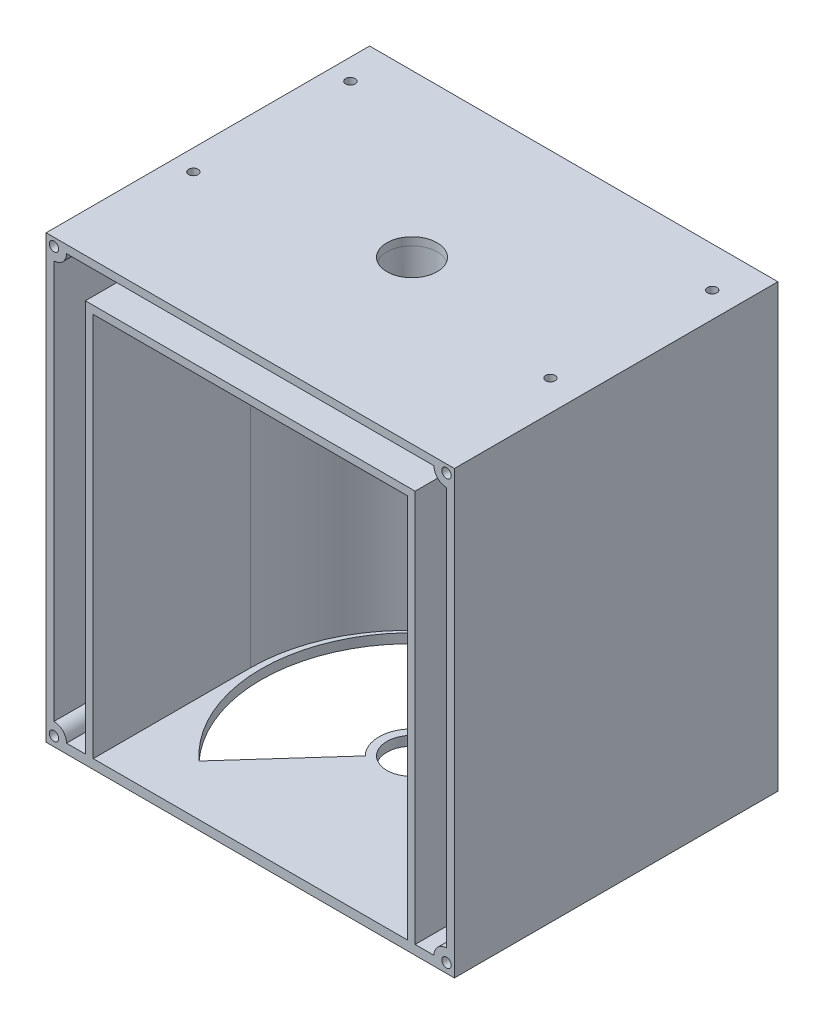
from build123d import *
from build123d.topology import SkipClean

# Parameters (mm, degrees)
BOSS_EXTRUDE2_DEPTH              = 2
BOSS_EXTRUDE2_DEPTH_BACK         = 3
SKETCH1_W                        = 105
SKETCH1_H                        = 155
SKETCH1_5_W                      = 105
SKETCH1_5_H                      = 155
SKETCH1_5_W_2                    = 100
SKETCH1_5_H_2                    = 150
BOSS_EXTRUDE3_DEPTH              = 100
BOSS_EXTRUDE5_DEPTH              = 153
CUT_EXTRUDE1_DEPTH               = 152.5
BOSS_EXTRUDE6_DEPTH              = 2.5
SKETCH5_R                        = 8
CUT_EXTRUDE2_DEPTH               = 162.5
BOSS_EXTRUDE12_DEPTH             = 3
BOSS_EXTRUDE13_DEPTH             = 103
BOSS_EXTRUDE14_DEPTH             = 3
CUT_EXTRUDE7_DEPTH               = 3
SKETCH15_W                       = 130
SKETCH15_H                       = 103
CUT_EXTRUDE8_DEPTH               = 30
SKETCH16_W                       = 130
SKETCH16_H                       = 103
BOSS_EXTRUDE15_DEPTH             = 3
SKETCH5_2_R                      = 8
CUT_EXTRUDE9_DEPTH               = 222
SKETCH18_R                       = 1.5
CUT_EXTRUDE11_DEPTH              = 5
BOSS_EXTRUDE17_REACH             = 203.791
SKETCH19_R                       = 10.02081528
SKETCH19_R_2                     = 8.1
BOSS_EXTRUDE17_DIRECTION_2_DEPTH = 7
SKETCH21_R                       = 1.5
CUT_EXTRUDE13_DEPTH              = 4
BOSS_EXTRUDE19_DEPTH             = 10
SKETCH22_3_R                     = 1.5
CUT_EXTRUDE14_DEPTH              = 10
CUT_EXTRUDE15_DEPTH              = 10


with BuildPart() as part:
    # Sketch1 → Boss-Extrude2 (new, two sides: drawn at the far end of the back side and taken through both)
    with BuildSketch(Plane.XY.offset(-BOSS_EXTRUDE2_DEPTH_BACK)):
        with Locations((-54.732014652, -17.403043174)):
            Rectangle(SKETCH1_W, SKETCH1_H)
    extrude(amount=BOSS_EXTRUDE2_DEPTH + BOSS_EXTRUDE2_DEPTH_BACK)

    # Sketch1<5> → Boss-Extrude3 (add)
    with BuildSketch(Plane.XY):
        with Locations((-54.732014652, -17.403043174)):
            Rectangle(SKETCH1_5_W, SKETCH1_5_H)
        with Locations((-54.732014652, -17.403043174)):
            Rectangle(SKETCH1_5_W_2, SKETCH1_5_H_2, mode=Mode.SUBTRACT)
    extrude(amount=BOSS_EXTRUDE3_DEPTH)

    # Sketch4 → Boss-Extrude5 (add)
    with BuildSketch(Plane.XZ.offset(94.903043174)):
        with BuildLine():
            ThreePointArc((-4.732014652, 50), (-14.732014652, 20), (-40.732014652, 2))
            Line((-40.732014652, 2), (-4.732014652, 2))
            Line((-4.732014652, 2), (-4.732014652, 50))
        make_face()
        with BuildLine():
            ThreePointArc((-68.732014652, 2), (-94.732014652, 20), (-104.732014652, 50))
            Line((-104.732014652, 50), (-104.732014652, 2))
            Line((-104.732014652, 2), (-68.732014652, 2))
        make_face()
    extrude(amount=-BOSS_EXTRUDE5_DEPTH)

    # Sketch4<3> → Cut-Extrude1 (cut)
    with SkipClean():  # the faces are left unmerged after this step: merging them gives an invalid solid
        with BuildSketch(Plane.XZ.offset(94.903043174)):
            with BuildLine():
                Line((-40.732014652, 2), (-68.732014652, 2))
                ThreePointArc((-68.732014652, 2), (-54.732014652, 0), (-40.732014652, 2))
            make_face()
        extrude(amount=-CUT_EXTRUDE1_DEPTH, mode=Mode.SUBTRACT)

    # Sketch4<4> → Boss-Extrude6 (add)
    with BuildSketch(Plane.XZ.offset(94.903043174)):
        with BuildLine():
            Line((-40.732014652, 2), (-68.732014652, 2))
            ThreePointArc((-68.732014652, 2), (-54.732014652, 0), (-40.732014652, 2))
        make_face()
    extrude(amount=-BOSS_EXTRUDE6_DEPTH)

    # Sketch5 → Cut-Extrude2 (cut)
    with BuildSketch(Plane.XZ.offset(94.903043174)):
        with Locations(Location((-54.732014652, 48.5, 0), (0, 0, 270))):
            Circle(SKETCH5_R)
    extrude(amount=-CUT_EXTRUDE2_DEPTH, mode=Mode.SUBTRACT)

    # Sketch13 → Boss-Extrude12 (add)
    with BuildSketch(Plane.XY.offset(100)):
        Polygon((-117.232014652, 70.096956826), (7.767985348, 70.096956826), (7.767985348, -92.403043174), (-2.232014652, -92.403043174), (-2.232014652, -94.903043174), (7.767985348, -94.903043174), (10.267985348, -94.903043174), (10.267985348, 72.596956826), (-119.732014652, 72.596956826), (-119.732014652, -94.903043174), (-117.232014652, -94.903043174), (-107.232014652, -94.903043174), (-107.232014652, -92.403043174), (-117.232014652, -92.403043174), align=None)
        Polygon((7.767985348, -92.403043174), (7.767985348, 70.096956826), (-117.232014652, 70.096956826), (-117.232014652, -92.403043174), (-107.232014652, -92.403043174), (-107.232014652, 60.096956826), (-2.232014652, 60.096956826), (-2.232014652, -92.403043174), align=None)
    extrude(amount=-BOSS_EXTRUDE12_DEPTH)

    # Sketch13<4> → Boss-Extrude13 (add)
    with BuildSketch(Plane.XY.offset(100)):
        Polygon((-117.232014652, 70.096956826), (7.767985348, 70.096956826), (7.767985348, -92.403043174), (-2.232014652, -92.403043174), (-2.232014652, -94.903043174), (7.767985348, -94.903043174), (10.267985348, -94.903043174), (10.267985348, 72.596956826), (-119.732014652, 72.596956826), (-119.732014652, -94.903043174), (-117.232014652, -94.903043174), (-107.232014652, -94.903043174), (-107.232014652, -92.403043174), (-117.232014652, -92.403043174), align=None)
    extrude(amount=-BOSS_EXTRUDE13_DEPTH)

    # Sketch14 → Boss-Extrude14 (add)
    with BuildSketch(Plane(origin=(0, 0, -3), x_dir=(-1, 0, 0), z_dir=(0, 0, -1))):
        Polygon((117.232014652, -92.403043174), (107.232014652, -92.403043174), (107.232014652, 60.096956826), (2.232014652, 60.096956826), (2.232014652, -92.403043174), (-7.767985348, -92.403043174), (-7.767985348, 70.096956826), (117.232014652, 70.096956826), align=None)
    extrude(amount=-BOSS_EXTRUDE14_DEPTH)

    # Sketch13<5> → Cut-Extrude7 (cut)
    with BuildSketch(Plane.XY.offset(100)):
        Polygon((7.767985348, -92.403043174), (7.767985348, 70.096956826), (-117.232014652, 70.096956826), (-117.232014652, -92.403043174), (-107.232014652, -92.403043174), (-107.232014652, 60.096956826), (-2.232014652, 60.096956826), (-2.232014652, -92.403043174), align=None)
    extrude(amount=-CUT_EXTRUDE7_DEPTH, mode=Mode.SUBTRACT)

    # Sketch15 → Cut-Extrude8 (cut)
    with BuildSketch(Plane.XZ.offset(94.903043174)):
        with Locations((-54.732014652, 48.5)):
            Rectangle(SKETCH15_W, SKETCH15_H)
    extrude(amount=-CUT_EXTRUDE8_DEPTH, mode=Mode.SUBTRACT)

    # Sketch16 → Boss-Extrude15 (add)
    with BuildSketch(Plane.XZ.offset(64.903043174)):
        with Locations((-54.732014652, 48.5)):
            Rectangle(SKETCH16_W, SKETCH16_H)
    extrude(amount=BOSS_EXTRUDE15_DEPTH)

    # Sketch5<2> → Cut-Extrude9 (cut)
    with BuildSketch(Plane.XZ.offset(94.903043174)):
        with Locations(Location((-54.732014652, 48.5, 0), (0, 0, 270))):
            Circle(SKETCH5_2_R)
    extrude(amount=-CUT_EXTRUDE9_DEPTH, mode=Mode.SUBTRACT)

    # Sketch18 → Cut-Extrude11 (cut)
    with BuildSketch(Plane.XZ.offset(67.903043174)):
        with Locations(Location((4.017985348, 80, 0), (0, 0, 270))):
            Circle(SKETCH18_R)
        with Locations(Location((4.017985348, 20, 0), (0, 0, 270))):
            Circle(SKETCH18_R)
        with Locations(Location((-113.482014652, 20, 0), (0, 0, 270))):
            Circle(SKETCH18_R)
        with Locations(Location((-113.482014652, 80, 0), (0, 0, 270))):
            Circle(SKETCH18_R)
    extrude(amount=-CUT_EXTRUDE11_DEPTH, mode=Mode.SUBTRACT)

    # Boss-Extrude17: up to this face of the body (flat: up to its plane)
    boss_extrude17_end = Plane(part.part.faces().sort_by_distance((-118.073430919, 72.596956826, 48.5))[0])
    # Sketch19 → Boss-Extrude17 (add, up to the picked face)
    with BuildSketch(Plane(origin=(0, 60.096956826, 0), x_dir=(1, 0, 0), z_dir=(0, 1, 0)), mode=Mode.PRIVATE) as boss_extrude17_sk1:
        with Locations(Location((-54.732014652, -48.5, 0), (0, 0, 270))):
            Circle(SKETCH19_R)
        with Locations(Location((-54.732014652, -48.5, 0), (0, 0, 270))):
            Circle(SKETCH19_R_2, mode=Mode.SUBTRACT)
    boss_extrude17_tool1 = split(extrude(boss_extrude17_sk1.sketch, amount=BOSS_EXTRUDE17_REACH, mode=Mode.PRIVATE), bisect_by=boss_extrude17_end, keep=Keep.BOTH, mode=Mode.PRIVATE)
    add(boss_extrude17_tool1.solids().sort_by(Axis((-54.732015, 60.096957, 38.762616), (0, 1, 0)))[0])

    # Sketch19 → Boss-Extrude17 direction 2 (add)
    with BuildSketch(Plane(origin=(0, 60.096956826, 0), x_dir=(1, 0, 0), z_dir=(0, 1, 0))):
        with Locations(Location((-54.732014652, -48.5, 0), (0, 0, 270))):
            Circle(SKETCH19_R)
        with Locations(Location((-54.732014652, -48.5, 0), (0, 0, 270))):
            Circle(SKETCH19_R_2, mode=Mode.SUBTRACT)
    extrude(amount=-BOSS_EXTRUDE17_DIRECTION_2_DEPTH)

    # Sketch21 → Cut-Extrude13 (cut)
    with BuildSketch(Plane(origin=(0, 72.596956826, 0), x_dir=(1, 0, 0), z_dir=(0, 1, 0))):
        with Locations(Location((0.634360514, -59.784654703, 0), (0, 0, 180))):
            Circle(SKETCH21_R)
        with Locations(Location((2.134360514, -9.784654703, 0), (0, 0, 180))):
            Circle(SKETCH21_R)
        with Locations(Location((-113.07774633, -9.784654703, 0), (0, 0, 180))):
            Circle(SKETCH21_R)
        with Locations(Location((-113.07774633, -59.784654703, 0), (0, 0, 180))):
            Circle(SKETCH21_R)
    extrude(amount=-CUT_EXTRUDE13_DEPTH, mode=Mode.SUBTRACT)

    # Sketch22 → Boss-Extrude19 (add)
    with BuildSketch(Plane.XY.offset(100)):
        with BuildLine():
            Line((-117.232014652, 68.596956826), (-117.232014652, 66.096956826))
            ThreePointArc((-117.232014652, 66.096956826), (-114.403587527, 67.268529702), (-113.232014652, 70.096956826))
            Line((-113.232014652, 70.096956826), (-115.732014652, 70.096956826))
            ThreePointArc((-115.732014652, 70.096956826), (-116.17135448, 69.036296655), (-117.232014652, 68.596956826))
        make_face()
        with BuildLine():
            Line((6.267985348, 70.096956826), (3.767985348, 70.096956826))
            ThreePointArc((3.767985348, 70.096956826), (4.939558223, 67.268529702), (7.767985348, 66.096956826))
            Line((7.767985348, 66.096956826), (7.767985348, 68.596956826))
            ThreePointArc((7.767985348, 68.596956826), (6.707325176, 69.036296655), (6.267985348, 70.096956826))
        make_face()
        with BuildLine():
            Line((7.767985348, -63.403043174), (7.767985348, -60.903043174))
            ThreePointArc((7.767985348, -60.903043174), (4.939558223, -62.074616049), (3.767985348, -64.903043174))
            Line((3.767985348, -64.903043174), (6.267985348, -64.903043174))
            ThreePointArc((6.267985348, -64.903043174), (6.707325176, -63.842383002), (7.767985348, -63.403043174))
        make_face()
        with BuildLine():
            ThreePointArc((-113.232014652, -64.903043174), (-114.403587527, -62.074616049), (-117.232014652, -60.903043174))
            Line((-117.232014652, -60.903043174), (-117.232014652, -63.403043174))
            ThreePointArc((-117.232014652, -63.403043174), (-116.17135448, -63.842383002), (-115.732014652, -64.903043174))
            Line((-115.732014652, -64.903043174), (-113.232014652, -64.903043174))
        make_face()
    extrude(amount=-BOSS_EXTRUDE19_DEPTH)

    # Sketch22<3> → Cut-Extrude14 (cut)
    with BuildSketch(Plane.XY.offset(100)):
        with Locations((7.767985348, 70.096956826)):
            Circle(SKETCH22_3_R)
        with Locations((7.767985348, -64.903043174)):
            Circle(SKETCH22_3_R)
        with Locations((-117.232014652, -64.903043174)):
            Circle(SKETCH22_3_R)
        with Locations((-117.232014652, 70.096956826)):
            Circle(SKETCH22_3_R)
    extrude(amount=-CUT_EXTRUDE14_DEPTH, mode=Mode.SUBTRACT)

    # Sketch23 → Cut-Extrude15 (cut)
    with BuildSketch(Plane.XZ.offset(67.903043174)):
        with BuildLine():
            Line((-54.054153523, 38.001044888), (-54.732014652, 0.5))
            ThreePointArc((-54.732014652, 0.5), (-99.452133799, 31.061222992), (-87.226355717, 83.828710686))
            Line((-87.226355717, 83.828710686), (-62.17135448, 55.939339828))
            ThreePointArc((-62.17135448, 55.939339828), (-64.317159664, 44.162656427), (-54.054153523, 38.001044888))
        make_face()
    extrude(amount=-CUT_EXTRUDE15_DEPTH, mode=Mode.SUBTRACT)


solid = part.part
